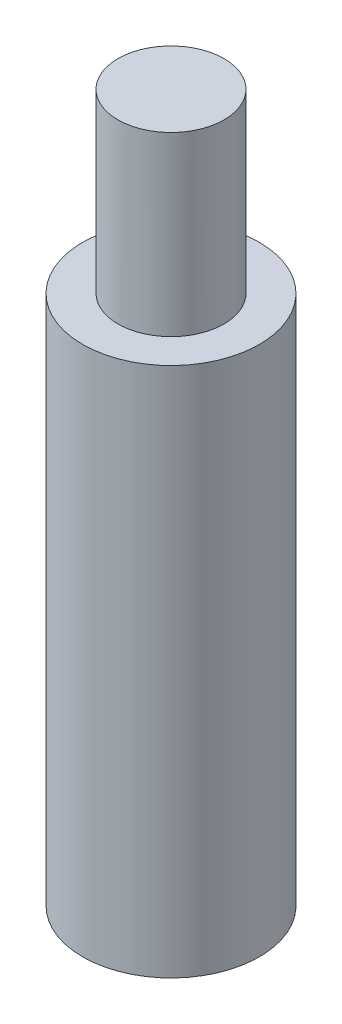
from build123d import *

# Parameters (mm, degrees)
SKETCH_1_R      = 1.5
EXTRUDE_1_DEPTH = 5
SKETCH_2_R      = 2.5
EXTRUDE_2_DEPTH = 15


with BuildPart() as part:
    # 草图1 → 凸台-拉伸1 (new body)
    with BuildSketch(Plane(origin=(0, 0, 0), x_dir=(1, 0, 0), z_dir=(0, 1, 0))):
        with Locations(Location((0, 0, 0), (0, 0, 270))):
            Circle(SKETCH_1_R)
    extrude(amount=EXTRUDE_1_DEPTH)

    # 草图2 → 凸台-拉伸2 (add)
    with BuildSketch(Plane.XZ):
        with Locations(Location((0, 0, 0), (0, 0, 270))):
            Circle(SKETCH_2_R)
    extrude(amount=EXTRUDE_2_DEPTH)


solid = part.part
